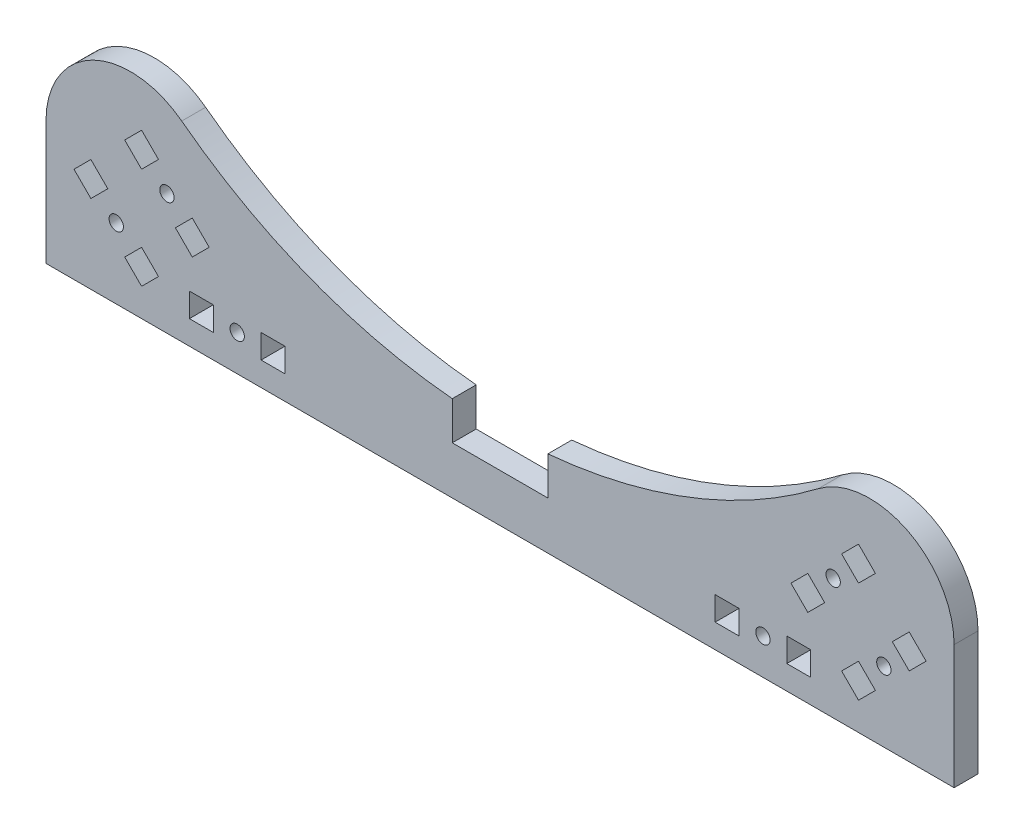
from build123d import *

# Parameters (mm, degrees)
SKETCH1_R           = 1.5
SKETCH1_W           = 5
SKETCH1_H           = 5
BOSS_EXTRUDE1_DEPTH = 5


with BuildPart() as part:
    # Sketch1 → Boss-Extrude1 (new body)
    with BuildSketch(Plane.XY):
        with BuildLine():
            Line((-95, 0), (95, 0))
            Line((95, 0), (95, 25.923215718))
            ThreePointArc((95, 25.923215718), (85.16818484, 41.770502039), (66.60299172, 40))
            ThreePointArc((66.60299172, 40), (39.84977522, 25.016488918), (10, 18))
            Line((10, 18), (10, 10))
            Line((10, 10), (-10, 10))
            Line((-10, 10), (-10, 18))
            ThreePointArc((-10, 18), (-39.84977522, 25.016488918), (-66.60299172, 40))
            ThreePointArc((-66.60299172, 40), (-85.16818484, 41.770502039), (-95, 25.923215718))
            Line((-95, 25.923215718), (-95, 0))
        make_face()
        with Locations((80.303300859, 14.696699141)):
            Circle(SKETCH1_R, mode=Mode.SUBTRACT)
        with Locations((69.696699141, 25.303300859)):
            Circle(SKETCH1_R, mode=Mode.SUBTRACT)
        with Locations(Location((-69.696699141, 25.303300859, 0), (0, 0, 180))):
            Circle(SKETCH1_R, mode=Mode.SUBTRACT)
        with Locations(Location((-80.303300859, 14.696699141, 0), (0, 0, 180))):
            Circle(SKETCH1_R, mode=Mode.SUBTRACT)
        with Locations((55, 7.5)):
            Circle(SKETCH1_R, mode=Mode.SUBTRACT)
        with Locations(Location((-55, 7.5, 0), (0, 0, 180))):
            Circle(SKETCH1_R, mode=Mode.SUBTRACT)
        Polygon((75, 12.928932188), (71.464466094, 9.393398282), (75, 5.857864376), (78.535533906, 9.393398282), align=None, mode=Mode.SUBTRACT)
        Polygon((82.071067812, 20), (85.606601718, 23.535533906), (89.142135624, 20), (85.606601718, 16.464466094), align=None, mode=Mode.SUBTRACT)
        Polygon((64.393398282, 23.535533906), (60.857864376, 20), (64.393398282, 16.464466094), (67.928932188, 20), align=None, mode=Mode.SUBTRACT)
        Polygon((71.464466094, 30.606601718), (75, 34.142135624), (78.535533906, 30.606601718), (75, 27.071067812), align=None, mode=Mode.SUBTRACT)
        Polygon((-64.393398282, 23.535533906), (-60.857864376, 20), (-64.393398282, 16.464466094), (-67.928932188, 20), align=None, mode=Mode.SUBTRACT)
        Polygon((-71.464466094, 30.606601718), (-75, 34.142135624), (-78.535533906, 30.606601718), (-75, 27.071067812), align=None, mode=Mode.SUBTRACT)
        Polygon((-75, 12.928932188), (-71.464466094, 9.393398282), (-75, 5.857864376), (-78.535533906, 9.393398282), align=None, mode=Mode.SUBTRACT)
        Polygon((-82.071067812, 20), (-85.606601718, 23.535533906), (-89.142135624, 20), (-85.606601718, 16.464466094), align=None, mode=Mode.SUBTRACT)
        with Locations((47.5, 7.5)):
            Rectangle(SKETCH1_W, SKETCH1_H, mode=Mode.SUBTRACT)
        with Locations((62.5, 7.5)):
            Rectangle(SKETCH1_W, SKETCH1_H, mode=Mode.SUBTRACT)
        with Locations((-47.5, 7.5)):
            Rectangle(SKETCH1_W, SKETCH1_H, mode=Mode.SUBTRACT)
        with Locations((-62.5, 7.5)):
            Rectangle(SKETCH1_W, SKETCH1_H, mode=Mode.SUBTRACT)
    extrude(amount=BOSS_EXTRUDE1_DEPTH)


solid = part.part
